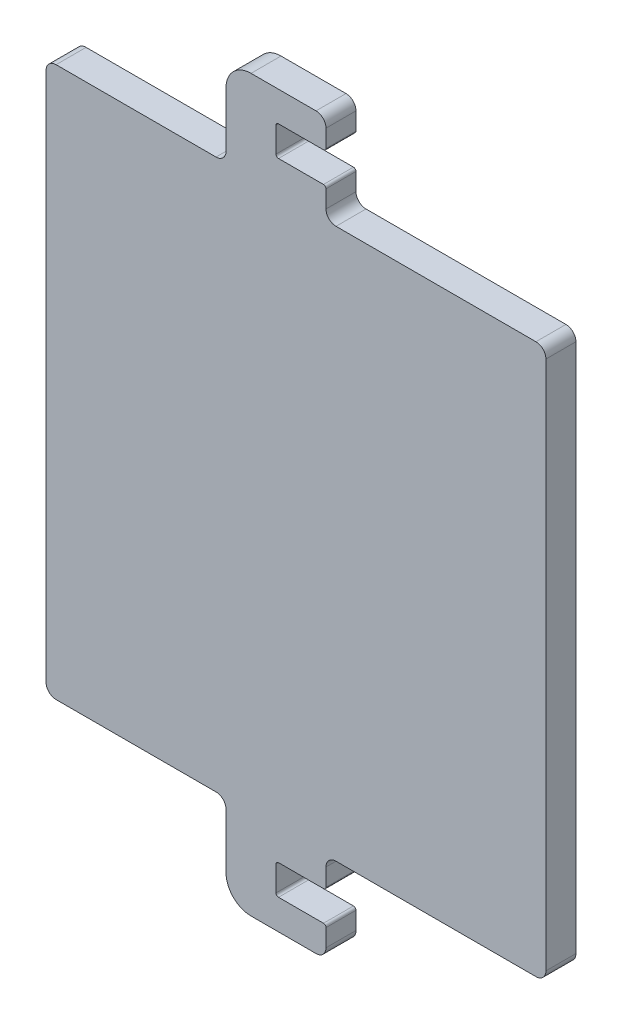
from build123d import *

# Parameters (mm, degrees)
SALIENTE_EXTRUIR1_DEPTH = 3
REDONDEO1_R             = 1
REDONDEO2_R             = 0.25


with BuildPart() as part:
    # Croquis1 → Saliente-Extruir1 (new body)
    with BuildSketch(Plane.XY):
        with BuildLine():
            Line((-7, 27.5), (-7, 34))
            ThreePointArc((-7, 34), (-6.267766953, 35.767766953), (-4.5, 36.5))
            Line((-4.5, 36.5), (3, 36.5))
            Line((3, 36.5), (3, 33.5))
            Line((3, 33.5), (-2, 33.5))
            Line((-2, 33.5), (-2, 30.5))
            Line((-2, 30.5), (3, 30.5))
            Line((3, 30.5), (3, 27.5))
            Line((3, 27.5), (25, 27.5))
            Line((25, 27.5), (25, -27.5))
            Line((25, -27.5), (3, -27.5))
            Line((3, -27.5), (3, -30.5))
            Line((3, -30.5), (-2, -30.5))
            Line((-2, -30.5), (-2, -33.5))
            Line((-2, -33.5), (3, -33.5))
            Line((3, -33.5), (3, -36.5))
            Line((3, -36.5), (-4.5, -36.5))
            ThreePointArc((-4.5, -36.5), (-6.267766953, -35.767766953), (-7, -34))
            Line((-7, -34), (-7, -27.5))
            Line((-7, -27.5), (-25, -27.5))
            Line((-25, -27.5), (-25, 27.5))
            Line((-25, 27.5), (-7, 27.5))
        make_face()
    extrude(amount=SALIENTE_EXTRUIR1_DEPTH)

    # Redondeo1
    redondeo1_edges = [part.edges().sort_by_distance(p)[0] for p in [
        (-25, 27.5, 1.5),
        (-25, -27.5, 1.5),
        (-7, -27.5, 1.5),
        (3, -36.5, 1.5),
        (3, -27.5, 1.5),
        (25, -27.5, 1.5),
        (25, 27.5, 1.5),
        (3, 27.5, 1.5),
        (3, 36.5, 1.5),
        (-7, 27.5, 1.5),
    ]]
    fillet(redondeo1_edges, radius=REDONDEO1_R)

    # Redondeo2
    redondeo2_edges = [part.edges().sort_by_distance(p)[0] for p in [
        (3, -33.5, 1.5),
        (-2, -33.5, 1.5),
        (-2, -30.5, 1.5),
        (3, -30.5, 1.5),
        (3, 30.5, 1.5),
        (-2, 30.5, 1.5),
        (-2, 33.5, 1.5),
        (3, 33.5, 1.5),
    ]]
    fillet(redondeo2_edges, radius=REDONDEO2_R)


solid = part.part
